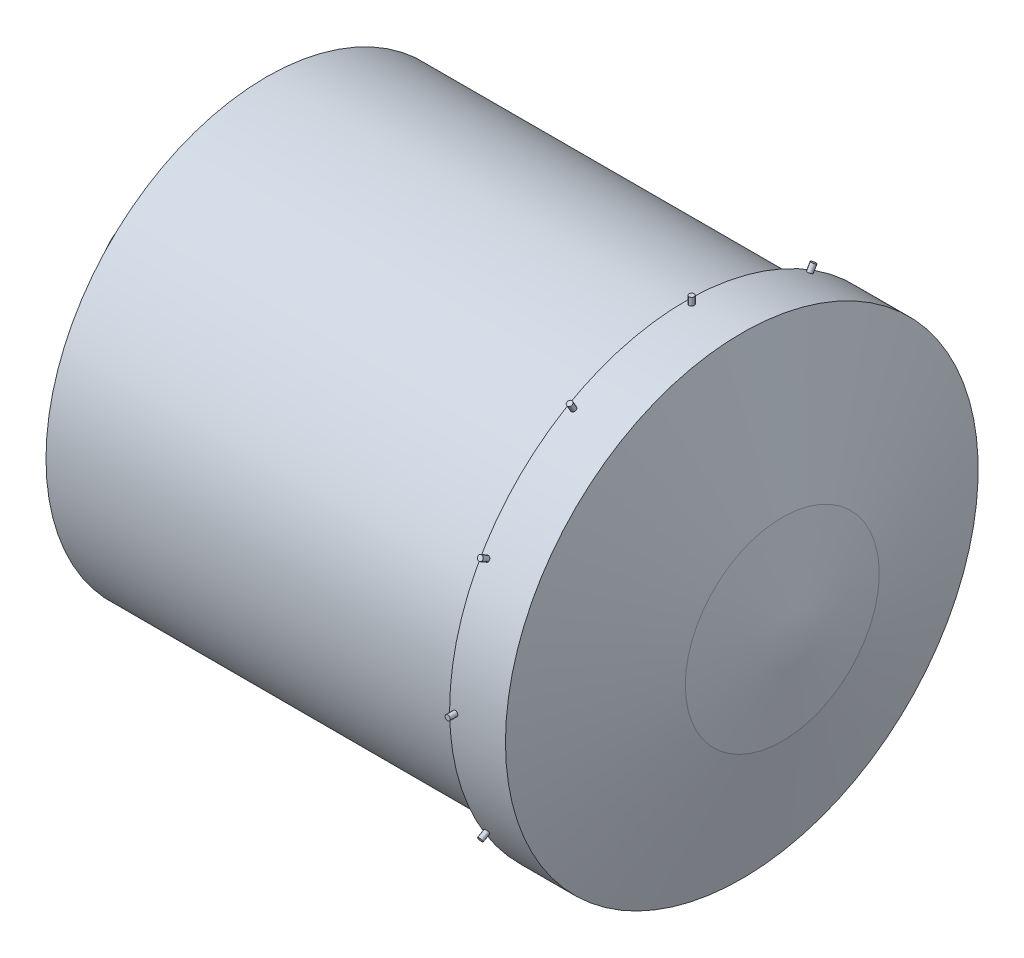
from build123d import *

# Parameters (mm, degrees)
SKETCH3_R           = 56.597826087
BOSS_EXTRUDE1_DEPTH = 33
CUT_EXTRUDE1_START  = -59
CUT_EXTRUDE1_DEPTH  = 59
SKETCH5_W           = 24.880010404
SKETCH5_H           = 32.839101301
BOSS_EXTRUDE2_DEPTH = 15.748
SKETCH6_R           = 3.785749492
BOSS_EXTRUDE3_DEPTH = 17.78
CIRPATTERN1_COUNT   = 12


with BuildPart() as part:
    # Sketch2 → Revolve1 (revolve)
    with BuildSketch(Plane.XY, mode=Mode.PRIVATE) as revolve1_sk:
        Polygon((-425.565469074, 0), (-425.565469074, 56.597826087), (-321.249748317, 56.597826087), (-321.249748317, 105.373188406), (-321.249748317, 108.594202899), (-298.702646868, 108.594202899), (-298.702646868, 271.025362319), (-297.782357013, 270.565217391), (-270.17366136, 270.565217391), (-270.17366136, 295.413043478), (-270.17366136, 322.208609609), (358.384309654, 322.208609609), (358.384309654, 173.014492754), (381.851700958, 173.014492754), (381.851700958, 154.148550725), (403.93865748, 154.148550725), (403.93865748, 122.398550725), (425.565469074, 122.398550725), (425.565469074, 0), align=None)
    revolve(revolve1_sk.sketch.rotate(Axis((-425.565469074, 0, 0), (1, 0, 0)), 90), axis=Axis((-425.565469074, 0, 0), (1, 0, 0)))

    # Sketch3 → Boss-Extrude1 (add)
    with BuildSketch(Plane.ZY.offset(425.565469074)):
        Circle(SKETCH3_R)
    extrude(amount=BOSS_EXTRUDE1_DEPTH)

    # Sketch4 → Cut-Extrude1 (cut)
    with BuildSketch(Plane.ZY.offset(458.565469074).offset(CUT_EXTRUDE1_START)):
        with BuildLine():
            Line((-9.718707111, 55.757157835), (-9.718707111, 10.801574681))
            Line((-9.718707111, 10.801574681), (3.10510749, 10.801574681))
            Line((3.10510749, 10.801574681), (3.10510749, 56.512584663))
            ThreePointArc((3.10510749, 56.512584663), (-3.328301731, 56.499878985), (-9.718707111, 55.757157835))
        make_face()
    extrude(amount=CUT_EXTRUDE1_DEPTH, mode=Mode.SUBTRACT)

    # Sketch5 → Boss-Extrude2 (add)
    with BuildSketch(Plane(origin=(358.384309654, 0, 0), x_dir=(0, 0, -1), z_dir=(1, 0, 0))):
        with Locations((0, 322.208609609)):
            Rectangle(SKETCH5_W, SKETCH5_H)
    boss_extrude2 = extrude(amount=-BOSS_EXTRUDE2_DEPTH)

    # Sketch6 → Boss-Extrude3 (add)
    with BuildSketch(Plane(origin=(0, 338.628160259, 0), x_dir=(1, 0, 0), z_dir=(0, 1, 0))):
        with Locations(Location((350.853731821, 0, 0), (0, 0, 270))):
            Circle(SKETCH6_R)
    boss_extrude3 = extrude(amount=BOSS_EXTRUDE3_DEPTH)

    # CirPattern1: Boss-Extrude2, Boss-Extrude3 ×12 about axis
    cirpattern1_axis = Axis((0, 0, 0), (1, 0, 0))
    add([boss_extrude2.rotate(cirpattern1_axis, i * 360 / CIRPATTERN1_COUNT) for i in range(1, CIRPATTERN1_COUNT)])
    add([boss_extrude3.rotate(cirpattern1_axis, i * 360 / CIRPATTERN1_COUNT) for i in range(1, CIRPATTERN1_COUNT)])

    # Sketch7 → Revolve2 (revolve)
    with BuildSketch(Plane.XY, mode=Mode.PRIVATE) as revolve2_sk:
        Polygon((342.636309654, 338.628160259), (417.278008104, 338.628160259), (475.115075851, 141.658905062), (496.908753553, 0), (509.178972274, 0), (483.303341634, 141.658905062), (424.19775265, 345.325998967), (342.636309654, 345.325998967), align=None)
    revolve(revolve2_sk.sketch.rotate(Axis((-501.828438053, 0, 0), (1, 0, 0)), 90), axis=Axis((-501.828438053, 0, 0), (1, 0, 0)))


solid = part.part
